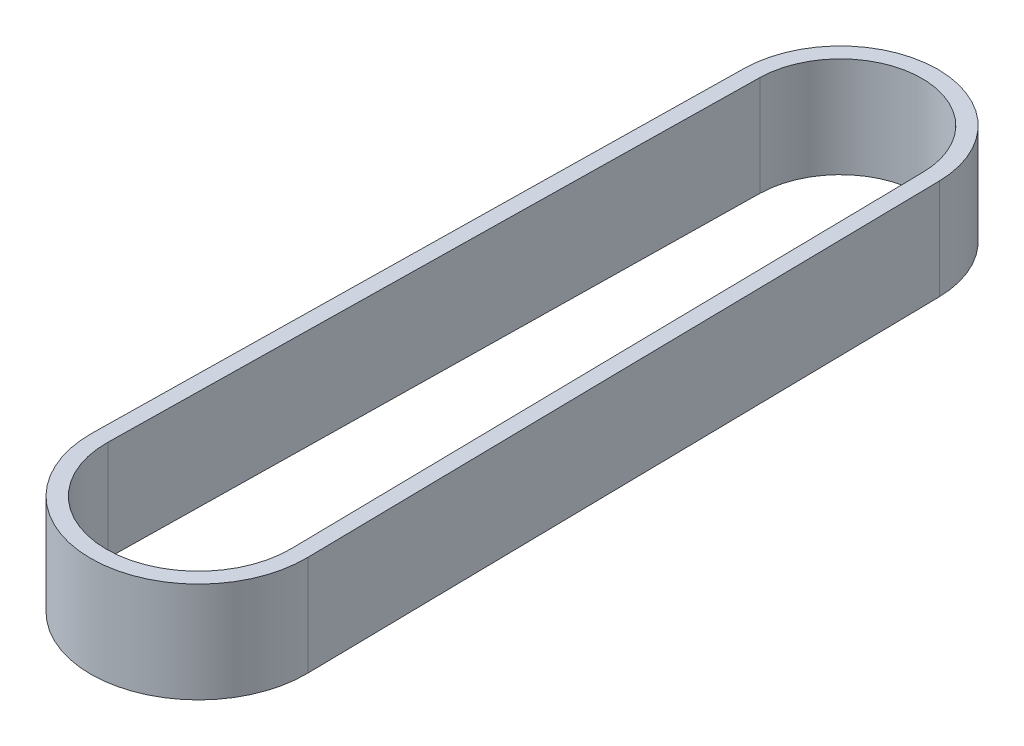
from build123d import *

# Parameters (mm, degrees)
BOSS_EXTRU_1_DEPTH = 3.175


with BuildPart() as part:
    # Esquisse1 → Boss.-Extru.1 (new, symmetric)
    with BuildSketch(Plane(origin=(0, 0, 0), x_dir=(1, 0, 0), z_dir=(0, 1, 0))):
        with BuildLine():
            Line((6.819140792, -12.39174635), (6.174222052, 28.23313494))
            ThreePointArc((6.174222052, 28.23313494), (0, 34.310119355), (-6.174222052, 28.23313494))
            Line((-6.174222052, 28.23313494), (-6.819140792, -12.39174635))
            ThreePointArc((-6.819140792, -12.39174635), (0, -19.32), (6.819140792, -12.39174635))
        make_face()
        with BuildLine():
            Line((5.819266776, -12.407619319), (5.174348035, 28.217261971))
            ThreePointArc((5.174348035, 28.217261971), (0, 33.310119355), (-5.174348035, 28.217261971))
            Line((-5.174348035, 28.217261971), (-5.819266776, -12.407619319))
            ThreePointArc((-5.819266776, -12.407619319), (0, -18.32), (5.819266776, -12.407619319))
        make_face(mode=Mode.SUBTRACT)
    extrude(amount=BOSS_EXTRU_1_DEPTH, both=True)


solid = part.part
